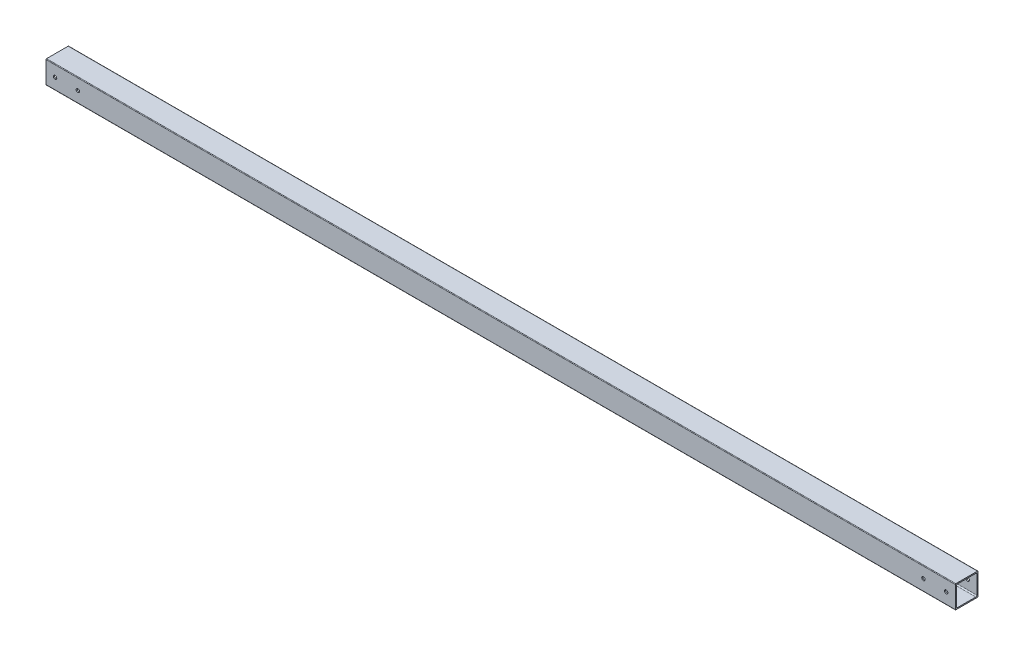
from build123d import *

# Parameters (mm, degrees)
BOSS_EXTRUDE1_DEPTH = 800
SKETCH2_R           = 1.5
CUT_EXTRUDE1_DEPTH  = 205
SKETCH3_R           = 1.5
CUT_EXTRUDE2_DEPTH  = 25


with BuildPart() as part:
    # Sketch1 → Boss-Extrude1 (new body)
    with BuildSketch(Plane(origin=(0, 0, 0), x_dir=(0, 0, -1), z_dir=(1, 0, 0))):
        with BuildLine():
            Line((-9.5, -10), (9.5, -10))
            ThreePointArc((9.5, -10), (9.853553391, -9.853553391), (10, -9.5))
            Line((10, -9.5), (10, 9.5))
            ThreePointArc((10, 9.5), (9.853553391, 9.853553391), (9.5, 10))
            Line((9.5, 10), (-9.5, 10))
            ThreePointArc((-9.5, 10), (-9.853553391, 9.853553391), (-10, 9.5))
            Line((-10, 9.5), (-10, -9.5))
            ThreePointArc((-10, -9.5), (-9.853553391, -9.853553391), (-9.5, -10))
        make_face()
        with BuildLine():
            Line((-8, -9), (8, -9))
            ThreePointArc((8, -9), (8.707106781, -8.707106781), (9, -8))
            Line((9, -8), (9, 8))
            ThreePointArc((9, 8), (8.707106781, 8.707106781), (8, 9))
            Line((8, 9), (-8, 9))
            ThreePointArc((-8, 9), (-8.707106781, 8.707106781), (-9, 8))
            Line((-9, 8), (-9, -8))
            ThreePointArc((-9, -8), (-8.707106781, -8.707106781), (-8, -9))
        make_face(mode=Mode.SUBTRACT)
    extrude(amount=BOSS_EXTRUDE1_DEPTH)

    # Sketch2 → Cut-Extrude1 (cut)
    with BuildSketch(Plane.XY.offset(10)):
        with Locations((792, 0)):
            Circle(SKETCH2_R)
        with Locations((772, 0)):
            Circle(SKETCH2_R)
    extrude(amount=-CUT_EXTRUDE1_DEPTH, mode=Mode.SUBTRACT)

    # Sketch3 → Cut-Extrude2 (cut)
    with BuildSketch(Plane.XY.offset(10)):
        with Locations((8, 0)):
            Circle(SKETCH3_R)
        with Locations((28, 0)):
            Circle(SKETCH3_R)
    extrude(amount=-CUT_EXTRUDE2_DEPTH, mode=Mode.SUBTRACT)


solid = part.part
